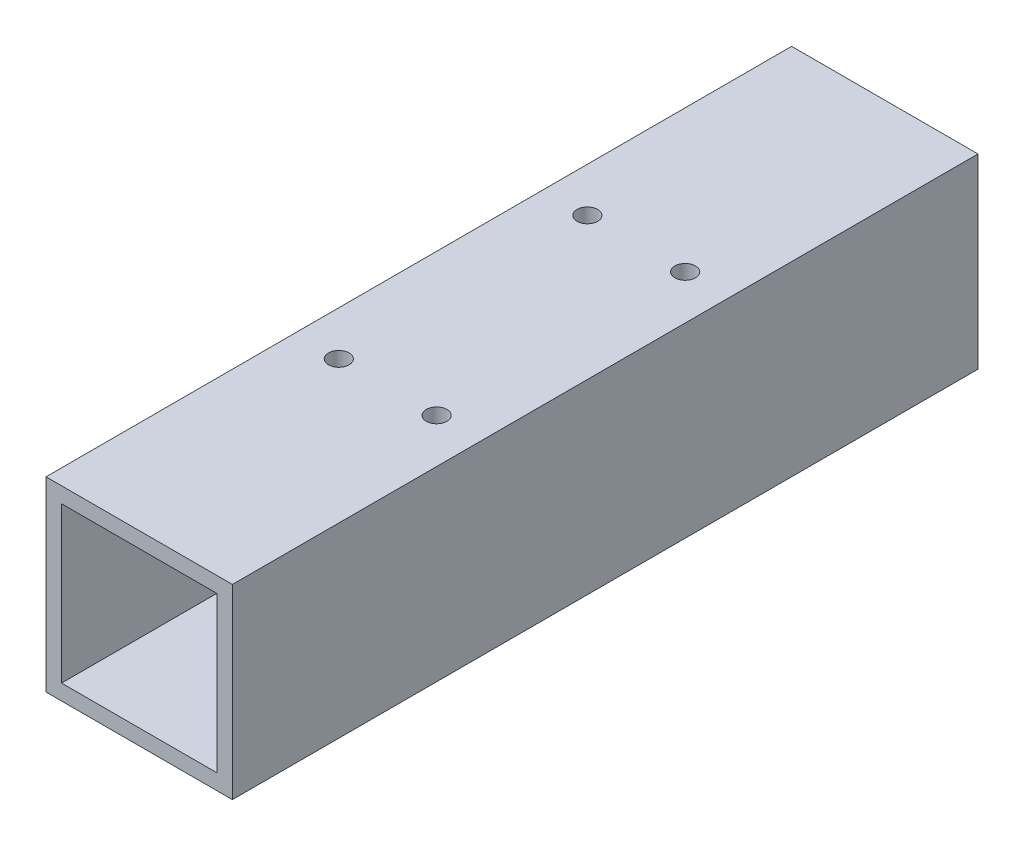
from build123d import *

# Parameters (mm, degrees)
BOSS_EXTRUDE1_DEPTH         = 152.4
BOSS_EXTRUDE1_DEPTH_BACK    = 152.4
SKETCH3_W                   = 76.2
SKETCH3_H                   = 76.2
SKETCH3_W_2                 = 63.5
SKETCH3_H_2                 = 63.5
F_5_16_CLEARANCE_HOLE3_D    = 8.4328
F_1_2_CLEARANCE_HOLE1_D     = 13.49248
F_1_2_CLEARANCE_HOLE1_DEPTH = 6.35
F_1_2_CLEARANCE_HOLE1_TIP   = 4.053549943


with BuildPart() as part:
    # Sketch3 → Boss-Extrude1 (new, two sides: drawn at the far end of the back side and taken through both)
    with BuildSketch(Plane.XY.offset(-BOSS_EXTRUDE1_DEPTH_BACK)):
        Rectangle(SKETCH3_W, SKETCH3_H)
        Rectangle(SKETCH3_W_2, SKETCH3_H_2, mode=Mode.SUBTRACT)
    extrude(amount=BOSS_EXTRUDE1_DEPTH + BOSS_EXTRUDE1_DEPTH_BACK)

    # 5/16 Clearance Hole3 (through all)
    with Locations(Plane(origin=(0, -38.1, 0), x_dir=(-1, 0, 0), z_dir=(0, -1, 0))):
        with Locations((20, 50.8), (-20, -50.8), (-20, 50.8), (20, -50.8)):
            Hole(F_5_16_CLEARANCE_HOLE3_D / 2)

    # 1/2 Clearance Hole1
    with Locations(Plane(origin=(0, -38.1, 0), x_dir=(-1, 0, 0), z_dir=(0, -1, 0))):
        with Locations((-20, 50.8), (20, 50.8), (-20, -50.8), (20, -50.8)):
            Hole(F_1_2_CLEARANCE_HOLE1_D / 2, depth=F_1_2_CLEARANCE_HOLE1_DEPTH)
            with Locations((0, 0, -(F_1_2_CLEARANCE_HOLE1_DEPTH + F_1_2_CLEARANCE_HOLE1_TIP / 2))):  # 118° drill point
                Cone(0, F_1_2_CLEARANCE_HOLE1_D / 2, F_1_2_CLEARANCE_HOLE1_TIP, mode=Mode.SUBTRACT)


solid = part.part
